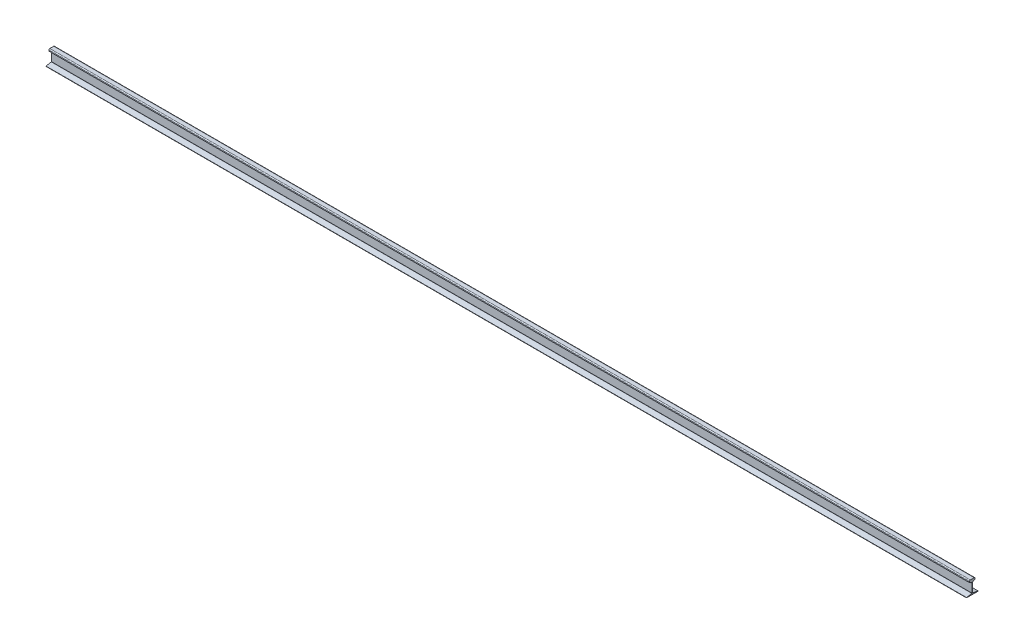
from build123d import *

# Parameters (mm, degrees)
BOSS_EXTRUDE1_DEPTH = 1524


with BuildPart() as part:
    # Sketch1 → Boss-Extrude1 (new body)
    with BuildSketch(Plane(origin=(0, 0, 0), x_dir=(0, 0, -1), z_dir=(1, 0, 0))):
        with BuildLine():
            Line((9.525, 0), (-9.525, 0))
            Line((-9.525, 0), (-9.525, 0.508))
            Line((-9.525, 0.508), (-0.715679151, 2.141916092))
            ThreePointArc((-0.715679151, 2.141916092), (-0.566703436, 2.229252122), (-0.508, 2.391656716))
            Line((-0.508, 2.391656716), (-0.508, 16.142634631))
            ThreePointArc((-0.508, 16.142634631), (-0.963665934, 17.594237711), (-2.167174412, 18.525017111))
            Line((-2.167174412, 18.525017111), (-4.6863, 19.4564))
            Line((-4.6863, 19.4564), (-4.6863, 21.1074))
            ThreePointArc((-4.6863, 21.1074), (-4.239930735, 22.185030735), (-3.1623, 22.6314))
            Line((-3.1623, 22.6314), (3.1623, 22.6314))
            ThreePointArc((3.1623, 22.6314), (4.239930735, 22.185030735), (4.6863, 21.1074))
            Line((4.6863, 21.1074), (4.6863, 19.4564))
            Line((4.6863, 19.4564), (2.167174412, 18.525017111))
            ThreePointArc((2.167174412, 18.525017111), (0.963665934, 17.594237711), (0.508, 16.142634631))
            Line((0.508, 16.142634631), (0.508, 2.391656716))
            ThreePointArc((0.508, 2.391656716), (0.566703436, 2.229252122), (0.715679151, 2.141916092))
            Line((0.715679151, 2.141916092), (9.525, 0.508))
            Line((9.525, 0.508), (9.525, 0))
        make_face()
    extrude(amount=BOSS_EXTRUDE1_DEPTH)


solid = part.part
